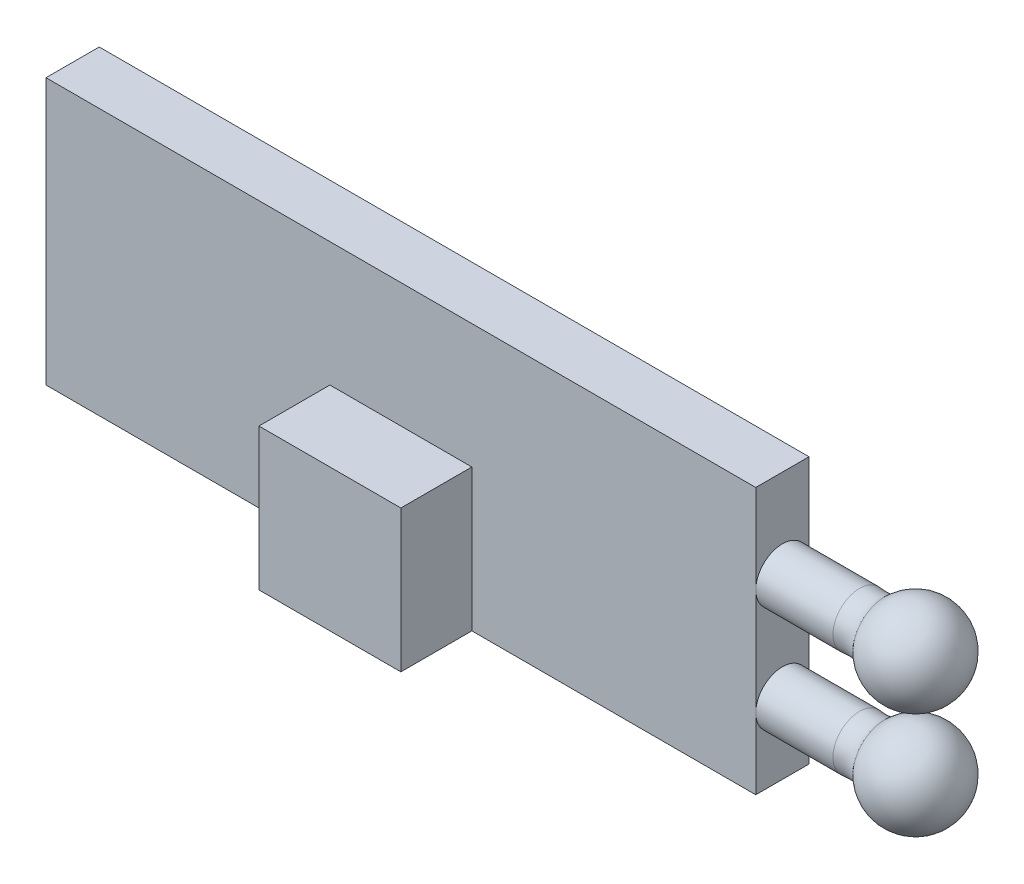
from build123d import *

# Parameters (mm, degrees)
SKETCH_1_W      = 40
SKETCH_1_H      = 15
EXTRUDE_1_DEPTH = 3
SKETCH_2_W      = 8
SKETCH_2_H      = 8
EXTRUDE_2_DEPTH = 4


with BuildPart() as part:
    # 草图1 → 凸台-拉伸1 (new body)
    with BuildSketch(Plane.XY):
        with Locations((20, 7.5)):
            Rectangle(SKETCH_1_W, SKETCH_1_H)
    extrude(amount=EXTRUDE_1_DEPTH)


with BuildPart() as body_2:
    # 草图2 → 凸台-拉伸2 (new body)
    with BuildSketch(Plane.XY.offset(3)):
        with Locations((20, 4)):
            Rectangle(SKETCH_2_W, SKETCH_2_H)
    extrude(amount=EXTRUDE_2_DEPTH)


with BuildPart() as body_3:
    # 草图3 → 旋转2 (revolve)
    with BuildSketch(Plane.XY.offset(1.5)):
        with BuildLine():
            Line((40, 7.5), (44.349624285, 7.5))
            add(Edge.make_bspline(
                [(45.796855132, 7.830108619), (45.482379037, 7.404263724), (44.785241795, 7.457676464), (44.349624285, 7.5)],
                knots=[0, 0, 0, 0, 1, 1, 1, 1], degree=3))
            ThreePointArc((45.796855132, 7.830108619), (48.498032522, 8.29214552), (50, 6))
            Line((50, 6), (40, 6))
            Line((40, 6), (40, 7.5))
        make_face()
    revolve(axis=Axis((40, 6, 1.5), (1, 0, 0)))


with BuildPart() as body_4:
    # Move Body 1: copy of body 3
    add(body_3.part.moved(Location((0, 5, 0))))


with BuildPart() as body_4_1:
    # Move Body 2: moved
    add(body_4.part.moved(Location((0, -2, 0))))


with BuildPart() as body_3_1:
    # Move Body 2: moved
    add(body_3.part.moved(Location((0, -2, 0))))


with BuildPart() as body_4_2:
    # Move Body 3: moved
    add(body_4_1.part.moved(Location((0, 1, 0))))


solid = Compound([part.part, body_2.part, body_3_1.part, body_4_2.part])
